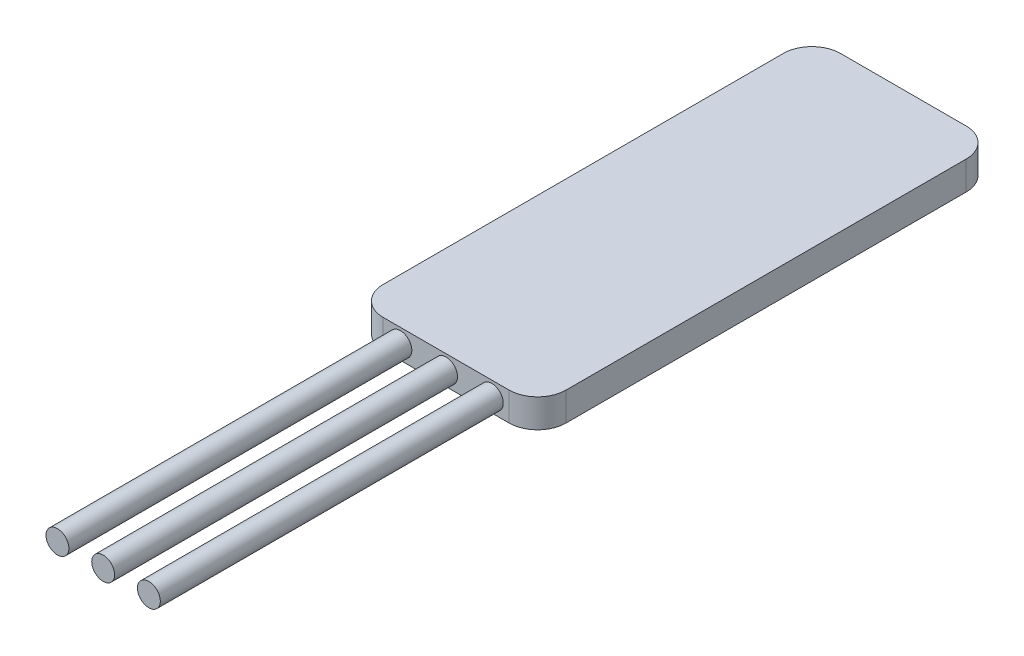
from build123d import *

# Parameters (mm, degrees)
SKETCH1_W         = 6.4
SKETCH1_H         = 16
BASE_DEPTH        = 0.5
BF_R              = 1
SKETCH2_R         = 0.4
WIRE_2_DEPTH      = 12
WIRE_LP_COUNT     = 2
WIRE_LP_PITCH     = 1.6
WIRE_LP_COL_COUNT = 2
WIRE_LP_COL_PITCH = 1.6


with BuildPart() as part:
    # Sketch1 → BASE (new, symmetric)
    with BuildSketch(Plane(origin=(0, 0, 0), x_dir=(1, 0, 0), z_dir=(0, 1, 0))):
        Rectangle(SKETCH1_W, SKETCH1_H)
    extrude(amount=BASE_DEPTH, both=True)

    # BF
    bf_edges = [part.edges().sort_by_distance(p)[0] for p in [
        (3.2, 0, 8),
        (-3.2, 0, 8),
        (-3.2, 0, -8),
        (3.2, 0, -8),
    ]]
    fillet(bf_edges, radius=BF_R)

    # Sketch2 → WIRE 2 (add)
    with BuildSketch(Plane.XY.offset(8)):
        with Locations(Location((0, 0, 0), (0, 0, 180))):
            Circle(SKETCH2_R)
    wire_2 = extrude(amount=WIRE_2_DEPTH)

    # WIRE LP: WIRE 2 ×2
    with Locations(*[(-i * WIRE_LP_PITCH, 0, 0) for i in range(1, WIRE_LP_COUNT)]):
        add(wire_2)

    # WIRE LP col: WIRE 2 ×2
    with Locations(*[(i * WIRE_LP_COL_PITCH, 0, 0) for i in range(1, WIRE_LP_COL_COUNT)]):
        add(wire_2)


solid = part.part
